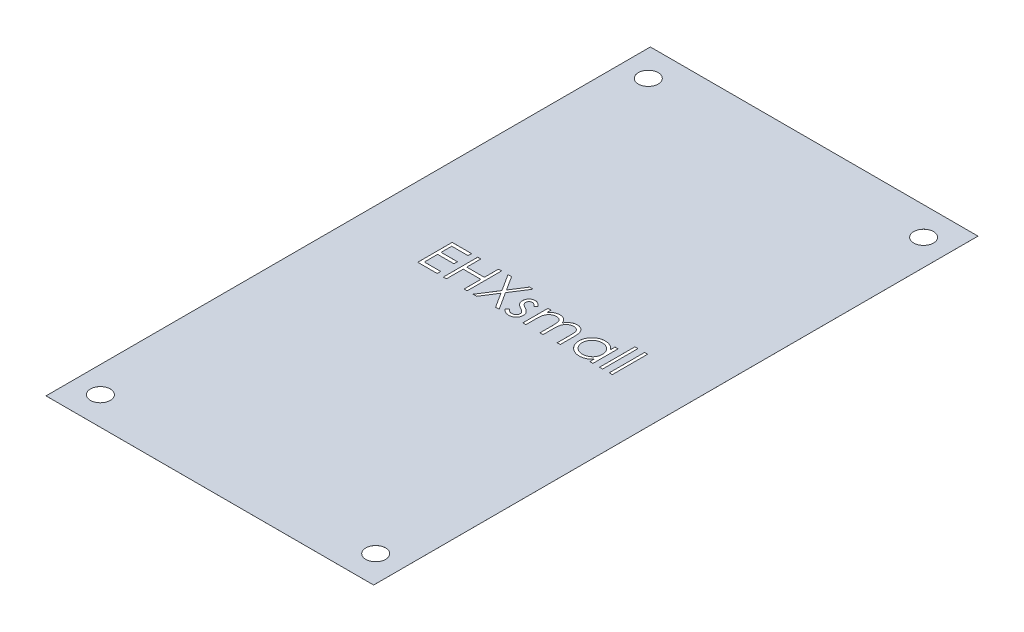
from build123d import *

# Parameters (mm, degrees)
SKETCH2_W           = 60.452
SKETCH2_H           = 111.506
BOSS_EXTRUDE1_DEPTH = 0.00254
SKETCH3_R           = 1.8288
CUT_EXTRUDE1_DEPTH  = 64.419303776
SKETCH5_W           = 0.569871795
SKETCH5_H           = 6.512820513
CUT_EXTRUDE2_DEPTH  = 2.54


with BuildPart() as part:
    # Sketch2 → Boss-Extrude1 (new body)
    with BuildSketch(Plane(origin=(0, 0, 0), x_dir=(1, 0, 0), z_dir=(0, 1, 0))):
        Rectangle(SKETCH2_W, SKETCH2_H)
    extrude(amount=BOSS_EXTRUDE1_DEPTH)

    # Sketch3 → Cut-Extrude1 (cut, through all)
    with BuildSketch(Plane(origin=(0, 0.00254, 0), x_dir=(1, 0, 0), z_dir=(0, 1, 0))):
        with Locations(Location((-25.4, 50.546, 0), (0, 0, 270))):
            Circle(SKETCH3_R)
        with Locations(Location((25.4, 50.546, 0), (0, 0, 270))):
            Circle(SKETCH3_R)
        with Locations(Location((25.4, -50.546, 0), (0, 0, 270))):
            Circle(SKETCH3_R)
        with Locations(Location((-25.4, -50.546, 0), (0, 0, 270))):
            Circle(SKETCH3_R)
    extrude(amount=-CUT_EXTRUDE1_DEPTH, mode=Mode.SUBTRACT)

    # Sketch5 → Cut-Extrude2 (cut)
    # profile 1 of 8: a face of its own
    with BuildSketch(Plane(origin=(0, 0.00254, 0), x_dir=(1, 0, 0), z_dir=(0, 1, 0))):
        Polygon((-17.28043017, 6.240856852), (-13.698378888, 6.240856852), (-13.698378888, 5.589574801), (-16.710558375, 5.589574801), (-16.710558375, 3.635728647), (-13.698378888, 3.635728647), (-13.698378888, 2.984446596), (-16.710558375, 2.984446596), (-16.710558375, 0.542138904), (-13.698378888, 0.542138904), (-13.698378888, -0.109143148), (-17.28043017, -0.109143148), align=None)
    # profile 2 of 8: a face of its own
    with BuildSketch(Plane(origin=(0, 0.00254, 0), x_dir=(1, 0, 0), z_dir=(0, 1, 0))):
        Polygon((-12.558635298, 6.240856852), (-11.988763503, 6.240856852), (-11.988763503, 3.635728647), (-8.732353247, 3.635728647), (-8.732353247, 6.240856852), (-8.162481452, 6.240856852), (-8.162481452, -0.109143148), (-8.732353247, -0.109143148), (-8.732353247, 2.984446596), (-11.988763503, 2.984446596), (-11.988763503, -0.109143148), (-12.558635298, -0.109143148), align=None)
    # profile 3 of 8: a face of its own
    with BuildSketch(Plane(origin=(0, 0.00254, 0), x_dir=(1, 0, 0), z_dir=(0, 1, 0))):
        Polygon((-6.982032734, 6.240856852), (-6.324390506, 6.240856852), (-4.661840426, 3.643360859), (-2.999290346, 6.240856852), (-2.341648118, 6.240856852), (-4.332383295, 3.129458615), (-2.260237862, -0.109143148), (-2.91788009, -0.109143148), (-4.661840426, 2.615556372), (-6.405800763, -0.109143148), (-7.06344299, -0.109143148), (-4.990025522, 3.129458615), align=None)
    # profile 4 of 8: a face of its own
    with BuildSketch(Plane(origin=(0, 0.00254, 0), x_dir=(1, 0, 0), z_dir=(0, 1, 0))):
        with BuildLine():
            Line((0.87405701, 3.952465426), (0.487358292, 3.554318391))
            add(Edge.make_bspline(
                [(0.487358292, 3.554318391), (0.453992664, 3.592986528), (0.389667661, 3.667534144), (0.287647689, 3.767205679), (0.186004865, 3.850911268), (0.086130589, 3.921581795), (-0.014486556, 3.975010961), (-0.114665822, 4.014008782), (-0.214510933, 4.038142058), (-0.281251311, 4.041252539), (-0.31402392, 4.042779929)],
                knots=[0, 0, 0, 0, 1.26578478, 2.440284043, 3.530471711, 4.527705817, 5.468200915, 6.346673037, 7.188140097, 8, 8, 8, 8], degree=3))
            add(Edge.make_bspline(
                [(-0.31402392, 4.042779929), (-0.354191098, 4.040829803), (-0.433234422, 4.036992229), (-0.546492692, 3.998686434), (-0.651631683, 3.939887723), (-0.742630775, 3.856487579), (-0.819715566, 3.760758119), (-0.875983245, 3.65372193), (-0.910392958, 3.538609051), (-0.914755829, 3.458726309), (-0.916968631, 3.418210618)],
                knots=[0, 0, 0, 0, 0.99966794, 1.967205029, 2.953328237, 3.988086729, 5.028030931, 6.008226631, 6.989793394, 8, 8, 8, 8], degree=3))
            add(Edge.make_bspline(
                [(-0.916968631, 3.418210618), (-0.9149533, 3.381540195), (-0.91092832, 3.308302723), (-0.879637916, 3.200265576), (-0.829806614, 3.094933521), (-0.783233547, 3.030412248), (-0.759236259, 2.997166949)],
                knots=[0, 0, 0, 0, 0.960159726, 1.917612774, 2.927026955, 4, 4, 4, 4], degree=3))
            add(Edge.make_bspline(
                [(-0.759236259, 2.997166949), (-0.744788206, 2.979414917), (-0.714037347, 2.941631955), (-0.656327612, 2.889192107), (-0.5909725, 2.831239737), (-0.512377756, 2.77329719), (-0.423929462, 2.712279632), (-0.323709618, 2.650590047), (-0.214898731, 2.583526019), (-0.136998189, 2.540991115), (-0.096505891, 2.518881692)],
                knots=[0, 0, 0, 0, 0.66740084, 1.420478572, 2.27185888, 3.217733974, 4.268547843, 5.408967954, 6.65319498, 8, 8, 8, 8], degree=3))
            add(Edge.make_bspline(
                [(-0.096505891, 2.518881692), (-0.047132687, 2.491223083), (0.048240086, 2.437795757), (0.183754107, 2.354865295), (0.306739167, 2.272439711), (0.418237307, 2.191400514), (0.51610316, 2.109480311), (0.603305991, 2.029819095), (0.677670739, 1.950009921), (0.719315721, 1.894251272), (0.739221273, 1.867599641)],
                knots=[0, 0, 0, 0, 1.27191281, 2.456916733, 3.569705269, 4.599008579, 5.553216877, 6.436649441, 7.252746552, 8, 8, 8, 8], degree=3))
            add(Edge.make_bspline(
                [(0.739221273, 1.867599641), (0.772260372, 1.813776881), (0.838014313, 1.7066596), (0.907062882, 1.530277596), (0.947086523, 1.343205684), (0.952642266, 1.215240085), (0.955467266, 1.150171756)],
                knots=[0, 0, 0, 0, 0.995354457, 1.980940102, 2.973342416, 4, 4, 4, 4], degree=3))
            add(Edge.make_bspline(
                [(0.955467266, 1.150171756), (0.954161826, 1.104326305), (0.951589314, 1.013982836), (0.933703964, 0.880932502), (0.902942793, 0.753688376), (0.861044125, 0.630869788), (0.804466763, 0.514829998), (0.738158616, 0.402641374), (0.658556991, 0.296730757), (0.567676924, 0.197237215), (0.468171528, 0.106367359), (0.362024676, 0.026495329), (0.249105655, -0.039860969), (0.130221316, -0.094770952), (0.005101543, -0.138437649), (-0.126273225, -0.168668241), (-0.263485394, -0.186761679), (-0.35679376, -0.189273515), (-0.404338423, -0.190553404)],
                knots=[0, 0, 0, 0, 1.032770009, 2.035186124, 3.017557409, 3.978232242, 4.952395191, 5.920591857, 6.910227898, 7.931268572, 8.952309245, 9.941945286, 10.918353717, 11.897095711, 12.887975737, 13.898235213, 14.929059601, 16, 16, 16, 16], degree=3))
            add(Edge.make_bspline(
                [(-0.404338423, -0.190553404), (-0.468504584, -0.188752362), (-0.595945323, -0.185175303), (-0.784430956, -0.151600021), (-0.968618618, -0.099356949), (-1.14711447, -0.027300897), (-1.315926705, 0.063686825), (-1.470378526, 0.172657168), (-1.611006465, 0.296010449), (-1.691049618, 0.390558158), (-1.731071195, 0.437832013)],
                knots=[0, 0, 0, 0, 1.013940152, 2.01379169, 3.017749504, 4.037548394, 5.051665909, 6.043208538, 7.021604269, 8, 8, 8, 8], degree=3))
            Line((-1.731071195, 0.437832013), (-1.353276724, 0.867779929))
            add(Edge.make_bspline(
                [(-1.353276724, 0.867779929), (-1.317403918, 0.829036285), (-1.247859059, 0.753925873), (-1.136641137, 0.653914569), (-1.02346708, 0.570092263), (-0.909467006, 0.499982067), (-0.792953406, 0.445960979), (-0.674579221, 0.408008673), (-0.554585223, 0.383617067), (-0.473990776, 0.380753612), (-0.433595234, 0.379318391)],
                knots=[0, 0, 0, 0, 1.179806542, 2.287233372, 3.337373186, 4.324005949, 5.273901747, 6.200048787, 7.097828587, 8, 8, 8, 8], degree=3))
            add(Edge.make_bspline(
                [(-0.433595234, 0.379318391), (-0.378589854, 0.381805459), (-0.271118568, 0.386664772), (-0.117187749, 0.430782925), (0.024940902, 0.499961552), (0.148354686, 0.598086647), (0.253405749, 0.712306043), (0.329475437, 0.840964517), (0.377147927, 0.98028616), (0.38274681, 1.076864766), (0.385595471, 1.126003086)],
                knots=[0, 0, 0, 0, 1.072336372, 2.095165389, 3.102688358, 4.141489647, 5.156069229, 6.117746104, 7.042326257, 8, 8, 8, 8], degree=3))
            add(Edge.make_bspline(
                [(0.385595471, 1.126003086), (0.383624623, 1.166479109), (0.379733447, 1.246393597), (0.349174939, 1.36205493), (0.300891621, 1.471763482), (0.253348902, 1.535970413), (0.229135135, 1.568671356)],
                knots=[0, 0, 0, 0, 1.013901739, 2.00181326, 2.98231254, 4, 4, 4, 4], degree=3))
            add(Edge.make_bspline(
                [(0.229135135, 1.568671356), (0.214580219, 1.585064084), (0.182874356, 1.620773367), (0.12471699, 1.672344582), (0.055081326, 1.727930847), (-0.026815827, 1.786589587), (-0.121139565, 1.847547057), (-0.228272185, 1.910483453), (-0.346746044, 1.978388041), (-0.430512761, 2.023417987), (-0.474300362, 2.046956612)],
                knots=[0, 0, 0, 0, 0.615000592, 1.339693406, 2.178160186, 3.116406724, 4.166410947, 5.330106347, 6.604359322, 8, 8, 8, 8], degree=3))
            add(Edge.make_bspline(
                [(-0.474300362, 2.046956612), (-0.521556409, 2.073334751), (-0.613200965, 2.12449038), (-0.743008193, 2.204166697), (-0.860115536, 2.285205896), (-0.967340864, 2.363062047), (-1.061975831, 2.441840045), (-1.143647623, 2.521627344), (-1.215571743, 2.599206176), (-1.255390619, 2.654174129), (-1.274410538, 2.68043017)],
                knots=[0, 0, 0, 0, 1.262093308, 2.447601706, 3.550203992, 4.582594899, 5.537233252, 6.418365656, 7.244515135, 8, 8, 8, 8], degree=3))
            add(Edge.make_bspline(
                [(-1.274410538, 2.68043017), (-1.307304626, 2.733308643), (-1.373104297, 2.839084068), (-1.436994716, 3.015633075), (-1.480911368, 3.201497679), (-1.484834562, 3.329743829), (-1.486840426, 3.395313984)],
                knots=[0, 0, 0, 0, 0.985009483, 1.970363186, 2.962279964, 4, 4, 4, 4], degree=3))
            add(Edge.make_bspline(
                [(-1.486840426, 3.395313984), (-1.485871243, 3.438177206), (-1.483974415, 3.522066604), (-1.468835921, 3.645327035), (-1.441273817, 3.762435829), (-1.406702743, 3.875151709), (-1.358655006, 3.981291222), (-1.301240293, 4.082269777), (-1.233771679, 4.177947799), (-1.156041708, 4.266853482), (-1.070576795, 4.347606117), (-0.978239141, 4.417997913), (-0.881105447, 4.4780623), (-0.778764457, 4.528436234), (-0.670233028, 4.566538742), (-0.556269784, 4.59276857), (-0.437105403, 4.610285866), (-0.355641932, 4.611851748), (-0.31402392, 4.612651724)],
                knots=[0, 0, 0, 0, 1.087655834, 2.128696564, 3.144119009, 4.137814668, 5.115653402, 6.093965665, 7.082169637, 8.081268856, 9.086088321, 10.061021666, 11.022561449, 11.980240094, 12.950172527, 13.934149372, 14.944599409, 16, 16, 16, 16], degree=3))
            add(Edge.make_bspline(
                [(-0.31402392, 4.612651724), (-0.264689747, 4.610648135), (-0.165095945, 4.60660337), (-0.015681123, 4.574480189), (0.133513654, 4.521624414), (0.282871732, 4.448624391), (0.431298971, 4.354160202), (0.580100983, 4.239988473), (0.731064123, 4.106860334), (0.82532772, 4.00508031), (0.87405701, 3.952465426)],
                knots=[0, 0, 0, 0, 0.845714091, 1.707292901, 2.609013841, 3.555613372, 4.552488639, 5.621697636, 6.770543573, 8, 8, 8, 8], degree=3))
        make_face()
    # profile 5 of 8: a face of its own
    with BuildSketch(Plane(origin=(0, 0.00254, 0), x_dir=(1, 0, 0), z_dir=(0, 1, 0))):
        with BuildLine():
            Line((2.095210856, 4.531241468), (2.665082651, 4.531241468))
            Line((2.665082651, 4.531241468), (2.665082651, 3.724771115))
            add(Edge.make_bspline(
                [(2.665082651, 3.724771115), (2.716397817, 3.795324336), (2.814722595, 3.93051107), (2.975950279, 4.108656299), (3.137015512, 4.25983738), (3.253008933, 4.339199447), (3.308732491, 4.377325202)],
                knots=[0, 0, 0, 0, 1.134379233, 2.173579362, 3.122582517, 4, 4, 4, 4], degree=3))
            add(Edge.make_bspline(
                [(3.308732491, 4.377325202), (3.384686949, 4.41362065), (3.535268853, 4.485577423), (3.773700875, 4.558572594), (4.017676347, 4.603430992), (4.182428392, 4.60956577), (4.265303003, 4.612651724)],
                knots=[0, 0, 0, 0, 1.014936303, 2.012140481, 3.000054389, 4, 4, 4, 4], degree=3))
            add(Edge.make_bspline(
                [(4.265303003, 4.612651724), (4.321351726, 4.610755268), (4.432269133, 4.607002283), (4.596614554, 4.582581934), (4.756015178, 4.540370449), (4.909529203, 4.481574304), (5.054165292, 4.4103696), (5.18676998, 4.326822273), (5.305831043, 4.233029008), (5.411288308, 4.124754372), (5.506119254, 3.998957972), (5.593348018, 3.85224712), (5.673948047, 3.681327507), (5.718618135, 3.557291068), (5.742135936, 3.491988663)],
                knots=[0, 0, 0, 0, 1.009824226, 1.998387844, 2.986035974, 3.974953746, 4.955485308, 5.885931332, 6.793869504, 7.679848016, 8.601185859, 9.625726857, 10.749998409, 12, 12, 12, 12], degree=3))
            add(Edge.make_bspline(
                [(5.742135936, 3.491988663), (5.767012063, 3.536845824), (5.815964789, 3.625118417), (5.898162159, 3.750046978), (5.984282304, 3.866899301), (6.07505917, 3.975768099), (6.170172349, 4.076115753), (6.270069461, 4.168274032), (6.37418185, 4.252638705), (6.518947771, 4.351196437), (6.707293502, 4.455882866), (6.944761938, 4.546648757), (7.19177725, 4.602739448), (7.359449359, 4.6093258), (7.444119109, 4.612651724)],
                knots=[0, 0, 0, 0, 0.86119277, 1.694706429, 2.50939023, 3.298075842, 4.073795165, 4.829715201, 5.57930267, 6.321991688, 7.768977793, 9.186738141, 10.579381044, 12, 12, 12, 12], degree=3))
            add(Edge.make_bspline(
                [(7.444119109, 4.612651724), (7.521918335, 4.609717624), (7.674178972, 4.603975304), (7.89584344, 4.558884002), (8.10256643, 4.481454556), (8.293931982, 4.375802102), (8.466579072, 4.243034155), (8.61665009, 4.085066406), (8.743233464, 3.903016219), (8.825926139, 3.731762182), (8.882015261, 3.580568078), (8.916597786, 3.451742379), (8.947149804, 3.309953133), (8.972515778, 3.155030801), (8.991055151, 2.986428126), (9.004790592, 2.804421022), (9.014087125, 2.608868034), (9.014744028, 2.47394777), (9.015082651, 2.404398519)],
                knots=[0, 0, 0, 0, 1.209669288, 2.367440248, 3.500751976, 4.631527125, 5.755587489, 6.87532382, 8.007944318, 9.190864318, 9.82315674, 10.514484317, 11.263564316, 12.079023757, 12.955305781, 13.901327259, 14.918167583, 16, 16, 16, 16], degree=3))
            Line((9.015082651, 2.404398519), (9.015082651, -0.109143148))
            Line((9.015082651, -0.109143148), (8.445210856, -0.109143148))
            Line((8.445210856, -0.109143148), (8.445210856, 2.40694259))
            add(Edge.make_bspline(
                [(8.445210856, 2.40694259), (8.445069554, 2.466307059), (8.444797993, 2.580396542), (8.439910976, 2.744140275), (8.430702906, 2.89339858), (8.419935776, 3.02796794), (8.40497915, 3.148162171), (8.385664388, 3.253739845), (8.365203455, 3.345531474), (8.331211014, 3.447287589), (8.276876982, 3.559537828), (8.194113839, 3.680593458), (8.089846647, 3.785968624), (7.969450363, 3.877441856), (7.832383899, 3.951816033), (7.681317901, 4.00493108), (7.517190264, 4.037811159), (7.403574634, 4.041087787), (7.344900359, 4.042779929)],
                knots=[0, 0, 0, 0, 1.253487763, 2.409012846, 3.458416907, 4.410876679, 5.259312806, 6.014470957, 6.676830364, 7.243083969, 8.276244668, 9.299465089, 10.325150304, 11.392391894, 12.482080715, 13.603491619, 14.762376348, 16, 16, 16, 16], degree=3))
            add(Edge.make_bspline(
                [(7.344900359, 4.042779929), (7.272927728, 4.040210615), (7.130682446, 4.035132674), (6.923045635, 3.983291504), (6.723526791, 3.905131621), (6.538079335, 3.791861306), (6.367486058, 3.65613756), (6.22071111, 3.494757579), (6.09945843, 3.31218614), (6.017354788, 3.143191409), (5.965485627, 2.991391132), (5.931237509, 2.858771614), (5.904597641, 2.708037913), (5.879613967, 2.540202894), (5.86330766, 2.354111281), (5.848487899, 2.150623896), (5.841555762, 1.929128712), (5.840586101, 1.77559172), (5.840082651, 1.695874881)],
                knots=[0, 0, 0, 0, 1.090531906, 2.155305635, 3.229839962, 4.33261226, 5.44038871, 6.529323825, 7.629011124, 8.757537029, 9.370236727, 10.061839251, 10.834451254, 11.692844982, 12.636905849, 13.66920014, 14.789842145, 16, 16, 16, 16], degree=3))
            Line((5.840082651, 1.695874881), (5.840082651, -0.109143148))
            Line((5.840082651, -0.109143148), (5.270210856, -0.109143148))
            Line((5.270210856, -0.109143148), (5.270210856, 2.250482253))
            add(Edge.make_bspline(
                [(5.270210856, 2.250482253), (5.270066745, 2.317054417), (5.269789491, 2.445132569), (5.264933887, 2.62879938), (5.255705302, 2.795860769), (5.245036307, 2.946122567), (5.229687126, 3.079311692), (5.212252272, 3.196142182), (5.19166265, 3.296321144), (5.157572431, 3.406200428), (5.105476181, 3.527251246), (5.021677477, 3.656321384), (4.917160867, 3.769293504), (4.794567992, 3.865738662), (4.656671969, 3.945461064), (4.504302085, 4.002900899), (4.338830314, 4.036327825), (4.224752191, 4.040588668), (4.166084253, 4.042779929)],
                knots=[0, 0, 0, 0, 1.320475261, 2.540461679, 3.643808994, 4.639130445, 5.527981419, 6.302341397, 6.981980563, 7.553956391, 8.582137848, 9.585246428, 10.591171744, 11.620968678, 12.668337649, 13.738356861, 14.836885341, 16, 16, 16, 16], degree=3))
            add(Edge.make_bspline(
                [(4.166084253, 4.042779929), (4.097111984, 4.040003238), (3.9596527, 4.03446939), (3.757719127, 3.984659493), (3.562709387, 3.906637814), (3.377734433, 3.798397857), (3.207782764, 3.664323814), (3.058996336, 3.50663536), (2.933914897, 3.327294971), (2.850944319, 3.160082205), (2.797425658, 3.012084978), (2.761874123, 2.886262544), (2.73132223, 2.746562094), (2.708618219, 2.592552621), (2.686700894, 2.425237207), (2.676123047, 2.243782347), (2.665833213, 2.048343703), (2.665338975, 1.913410656), (2.665082651, 1.843430971)],
                knots=[0, 0, 0, 0, 1.098833095, 2.189935336, 3.297829714, 4.440610912, 5.596351641, 6.740013378, 7.886572111, 9.072425424, 9.705826452, 10.395263256, 11.156850408, 11.985370555, 12.878090359, 13.847760091, 14.883794034, 16, 16, 16, 16], degree=3))
            Line((2.665082651, 1.843430971), (2.665082651, -0.109143148))
            Line((2.665082651, -0.109143148), (2.095210856, -0.109143148))
            Line((2.095210856, -0.109143148), (2.095210856, 4.531241468))
        make_face()
    # profile 6 of 8: a face of its own
    with BuildSketch(Plane(origin=(0, 0.00254, 0), x_dir=(1, 0, 0), z_dir=(0, 1, 0))):
        with BuildLine():
            Line((15.039441625, 4.531241468), (15.039441625, -0.109143148))
            Line((15.039441625, -0.109143148), (14.46956983, -0.109143148))
            Line((14.46956983, -0.109143148), (14.46956983, 0.693511099))
            add(Edge.make_bspline(
                [(14.46956983, 0.693511099), (14.405310024, 0.620867836), (14.279906205, 0.479103594), (14.070463034, 0.293897367), (13.848452197, 0.140810983), (13.614951229, 0.017167565), (13.370170987, -0.075709452), (13.114654086, -0.14172434), (12.848296295, -0.184167441), (12.66640988, -0.188405652), (12.574237298, -0.190553404)],
                knots=[0, 0, 0, 0, 1.074387032, 2.096679803, 3.090159297, 4.057316773, 5.018401886, 5.985159533, 6.978961417, 8, 8, 8, 8], degree=3))
            add(Edge.make_bspline(
                [(12.574237298, -0.190553404), (12.492289725, -0.188328414), (12.330685482, -0.183940636), (12.092961299, -0.149900457), (11.864193932, -0.0952349), (11.644167207, -0.019214715), (11.434304886, 0.081624776), (11.232810139, 0.202349611), (11.040726827, 0.346115117), (10.860982749, 0.510467683), (10.695461834, 0.688984303), (10.550207811, 0.879385509), (10.429098652, 1.080847975), (10.327825077, 1.290820983), (10.249817423, 1.510920908), (10.195436687, 1.740386627), (10.161436162, 1.978946826), (10.157050198, 2.141397104), (10.154826241, 2.223769513)],
                knots=[0, 0, 0, 0, 1.033919861, 2.038935746, 3.024066025, 3.998881131, 4.97069526, 5.957263378, 6.95902576, 7.993208707, 9.027059324, 10.027763471, 11.009749337, 11.988697705, 12.965288445, 13.950418724, 14.960734635, 16, 16, 16, 16], degree=3))
            add(Edge.make_bspline(
                [(10.154826241, 2.223769513), (10.157099489, 2.304439375), (10.161593577, 2.463919341), (10.195072991, 2.698467836), (10.251372106, 2.924379537), (10.330380344, 3.140927134), (10.431693605, 3.348372654), (10.554934563, 3.546862813), (10.700112118, 3.736944434), (10.867484342, 3.914147946), (11.048794568, 4.077833918), (11.242757551, 4.220090329), (11.444548362, 4.34294804), (11.657296966, 4.440290776), (11.877854428, 4.519047294), (12.108184251, 4.573535679), (12.347328115, 4.605643676), (12.509689437, 4.610293262), (12.592045792, 4.612651724)],
                knots=[0, 0, 0, 0, 1.020392517, 2.01726096, 2.990465484, 3.961182959, 4.928053699, 5.906110375, 6.912531644, 7.948652711, 8.985773172, 9.998621852, 10.987621588, 11.969261332, 12.953316658, 13.946091881, 14.958173133, 16, 16, 16, 16], degree=3))
            add(Edge.make_bspline(
                [(12.592045792, 4.612651724), (12.68675125, 4.610043232), (12.872464185, 4.604928102), (13.144113573, 4.562360011), (13.401097126, 4.490444507), (13.645398593, 4.39262276), (13.876140695, 4.262631495), (14.091138967, 4.098656422), (14.292643486, 3.901731697), (14.40944773, 3.750473891), (14.46956983, 3.67261767)],
                knots=[0, 0, 0, 0, 1.038897134, 2.037228247, 3.008116434, 3.962042015, 4.918381754, 5.904844433, 6.921570401, 8, 8, 8, 8], degree=3))
            Line((14.46956983, 3.67261767), (14.46956983, 4.531241468))
            Line((14.46956983, 4.531241468), (15.039441625, 4.531241468))
        make_face()
        with BuildLine():
            add(Edge.make_bspline(
                [(12.599678003, 4.042779929), (12.516376276, 4.039816044), (12.351951916, 4.033965805), (12.110572084, 3.988293892), (11.879589175, 3.912303271), (11.660158441, 3.808377536), (11.455746105, 3.677696828), (11.273059016, 3.519633747), (11.110602972, 3.338500879), (10.973972264, 3.135115621), (10.862592363, 2.917078227), (10.784275033, 2.689159604), (10.732623685, 2.455470573), (10.727346797, 2.296969701), (10.724698035, 2.217409336)],
                knots=[0, 0, 0, 0, 1.031046209, 2.035121221, 3.029706178, 4.034933723, 5.034054252, 6.02443088, 7.017295772, 8.038157696, 9.050218397, 10.03989886, 11.016116709, 12, 12, 12, 12], degree=3))
            add(Edge.make_bspline(
                [(10.724698035, 2.217409336), (10.728081485, 2.138324428), (10.734835121, 1.980464596), (10.783368524, 1.746456978), (10.864793437, 1.518484645), (10.975904037, 1.298482557), (11.115035484, 1.094222832), (11.276304897, 0.909637181), (11.461271836, 0.750906071), (11.666154599, 0.618032187), (11.884971916, 0.510694471), (12.115084906, 0.436008239), (12.35216785, 0.387788551), (12.51337137, 0.382156143), (12.594589862, 0.379318391)],
                knots=[0, 0, 0, 0, 0.979072187, 1.954306742, 2.945804271, 3.96968567, 4.997920485, 5.998718438, 6.996577872, 8.005894225, 9.015743152, 10.005417472, 10.995077863, 12, 12, 12, 12], degree=3))
            add(Edge.make_bspline(
                [(12.594589862, 0.379318391), (12.677042803, 0.38233004), (12.841033524, 0.388319911), (13.083129466, 0.434187349), (13.318070327, 0.509967883), (13.542655727, 0.615013442), (13.751872136, 0.745201787), (13.939646857, 0.897614653), (14.098425828, 1.074876144), (14.23303242, 1.269687709), (14.338579247, 1.483250902), (14.415461526, 1.710642934), (14.46091647, 1.95187172), (14.466645493, 2.116724844), (14.46956983, 2.200872878)],
                knots=[0, 0, 0, 0, 1.01762866, 2.023962475, 3.030623092, 4.058876274, 5.077231937, 6.066672613, 7.034107872, 8.005628644, 8.981990164, 9.965428785, 10.961468474, 12, 12, 12, 12], degree=3))
            add(Edge.make_bspline(
                [(14.46956983, 2.200872878), (14.467828739, 2.264985799), (14.464401722, 2.391180317), (14.438220545, 2.576468813), (14.39657375, 2.753785716), (14.337888556, 2.923317452), (14.260797226, 3.084126694), (14.167819136, 3.237368087), (14.057319249, 3.382244628), (13.931076358, 3.516761343), (13.792890919, 3.639455067), (13.646669395, 3.748973047), (13.490679383, 3.838941249), (13.327544187, 3.913401841), (13.156980766, 3.97265487), (12.977601213, 4.012183972), (12.791312194, 4.039326269), (12.664228636, 4.041616588), (12.599678003, 4.042779929)],
                knots=[0, 0, 0, 0, 1.050140795, 2.067009409, 3.05949893, 4.030605086, 5.00011959, 5.97591094, 6.962425594, 7.979863591, 8.993523472, 9.986985069, 10.967611495, 11.937549037, 12.921786183, 13.919465291, 14.943216303, 16, 16, 16, 16], degree=3))
        make_face(mode=Mode.SUBTRACT)
    # profile 7 of 8: a face of its own
    with BuildSketch(Plane(origin=(0, 0.00254, 0), x_dir=(1, 0, 0), z_dir=(0, 1, 0))):
        with Locations((16.545531369, 3.147267108)):
            Rectangle(SKETCH5_W, SKETCH5_H)
    # profile 8 of 8: a face of its own
    with BuildSketch(Plane(origin=(0, 0.00254, 0), x_dir=(1, 0, 0), z_dir=(0, 1, 0))):
        with Locations((18.336557009, 3.147267108)):
            Rectangle(SKETCH5_W, SKETCH5_H)
    extrude(amount=-CUT_EXTRUDE2_DEPTH, mode=Mode.SUBTRACT)


with BuildPart() as cut_extrude2_piece_1:
    # of the separate pieces the step leaves, piece 1, a body of its own (cut_extrude2_pieces)
    add(part.part.solids().sort_by_distance((-30.226, 0, 55.753))[0])


with BuildPart() as cut_extrude2_piece_2:
    # of the separate pieces the step leaves, piece 2, a body of its own (cut_extrude2_pieces)
    add(part.part.solids().sort_by_distance((10.724698035, 0, -2.217409336))[0])


solid = Compound([cut_extrude2_piece_1.part, cut_extrude2_piece_2.part])
